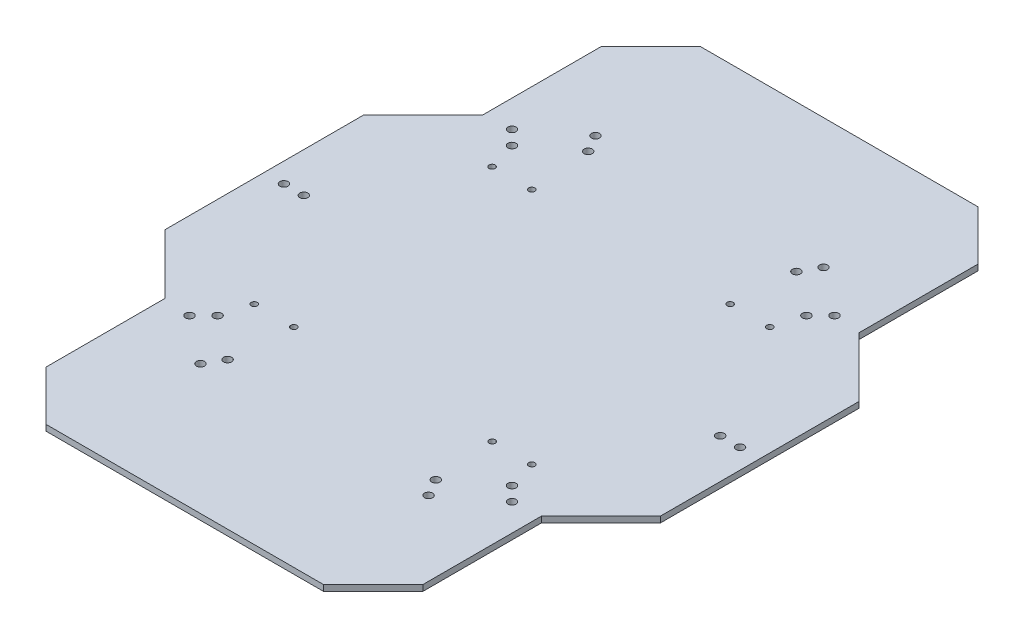
from build123d import *

# Parameters (mm, degrees)
BOSS_EXTRUDE1_DEPTH  = 3
SKETCH2_R            = 2.05
CUT_EXTRUDE1_DEPTH   = 3
SKETCH5_R            = 1.55
CUT_EXTRUDE2_DEPTH   = 3
LPATTERN1_COUNT      = 2
LPATTERN1_PITCH      = 120
LPATTERN1_COUNT_DIR2 = 2
LPATTERN1_PITCH_DIR2 = 120


with BuildPart() as part:
    # Sketch1 → Boss-Extrude1 (new body)
    with BuildSketch(Plane(origin=(0, 0, 0), x_dir=(1, 0, 0), z_dir=(0, 1, 0))):
        Polygon((-70, 165), (-95, 140), (-95, 80), (-125, 50), (-125, -50), (-95, -80), (-95, -140), (-70, -165), (70, -165), (95, -140), (95, -80), (125, -50), (125, 50), (95, 80), (95, 140), (70, 165), align=None)
    extrude(amount=BOSS_EXTRUDE1_DEPTH)

    # Sketch2 → Cut-Extrude1 (cut)
    with BuildSketch(Plane(origin=(0, 3, 0), x_dir=(1, 0, 0), z_dir=(0, 1, 0))):
        with Locations(Location((57.5, 99.592921435, 0), (0, 0, 270))):
            Circle(SKETCH2_R)
        with Locations(Location((52.5, 90.932667397, 0), (0, 0, 270))):
            Circle(SKETCH2_R)
        with Locations(Location((52.5, -90.932667397, 0), (0, 0, 270))):
            Circle(SKETCH2_R)
        with Locations(Location((57.5, -99.592921435, 0), (0, 0, 270))):
            Circle(SKETCH2_R)
        with Locations(Location((105, 0, 0), (0, 0, 270))):
            Circle(SKETCH2_R)
        with Locations(Location((115, 0, 0), (0, 0, 270))):
            Circle(SKETCH2_R)
        with Locations(Location((74.246212025, 74.246212025, 0), (0, 0, 270))):
            Circle(SKETCH2_R)
        with Locations(Location((81.317279836, 81.317279836, 0), (0, 0, 270))):
            Circle(SKETCH2_R)
        with Locations(Location((74.246212025, -74.246212025, 0), (0, 0, 270))):
            Circle(SKETCH2_R)
        with Locations(Location((81.317279836, -81.317279836, 0), (0, 0, 270))):
            Circle(SKETCH2_R)
    cut_extrude1 = extrude(amount=-CUT_EXTRUDE1_DEPTH, mode=Mode.SUBTRACT)

    # Mirror1: Cut-Extrude1 across plane
    add(cut_extrude1.mirror(Plane(origin=(0, 0, 0), x_dir=(0, 0, 1), z_dir=(1, 0, 0))), mode=Mode.SUBTRACT)

    # Sketch5 → Cut-Extrude2 (cut)
    with BuildSketch(Plane(origin=(0, 3, 0), x_dir=(1, 0, 0), z_dir=(0, 1, 0))):
        with Locations(Location((50, 60, 0), (0, 0, 270))):
            Circle(SKETCH5_R)
        with Locations(Location((70, 60, 0), (0, 0, 270))):
            Circle(SKETCH5_R)
    cut_extrude2 = extrude(amount=-CUT_EXTRUDE2_DEPTH, mode=Mode.SUBTRACT)

    # LPattern1: Cut-Extrude2 2 × 2
    with Locations(*[(-j * LPATTERN1_PITCH_DIR2, 0, i * LPATTERN1_PITCH) for i in range(LPATTERN1_COUNT) for j in range(LPATTERN1_COUNT_DIR2) if (i, j) != (0, 0)]):
        add(cut_extrude2, mode=Mode.SUBTRACT)


solid = part.part
